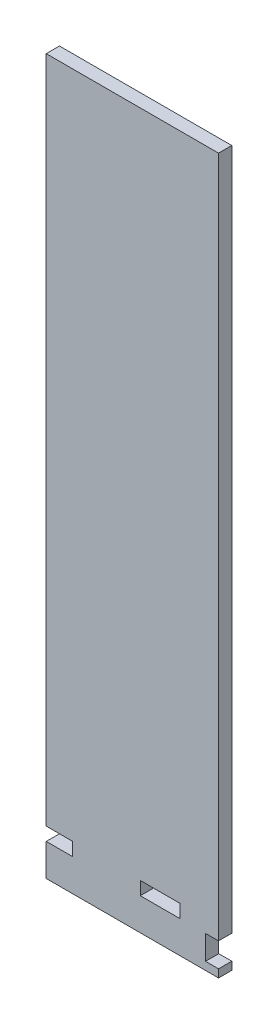
from build123d import *

# Parameters (mm, degrees)
ESQUISSE1_W             = 65.121094869
ESQUISSE1_H             = 270
BOSS_EXTRU_1_DEPTH      = 5
ESQUISSE2_W             = 10
ESQUISSE2_H             = 5
ESQUISSE2_W_2           = 15
ESQUISSE2_W_3           = 4.92
ESQUISSE2_H_2           = 9.15
ENL_V_MAT_EXTRU_1_DEPTH = 5


with BuildPart() as part:
    # Esquisse1 → Boss.-Extru.1 (new body)
    with BuildSketch(Plane.XY):
        with Locations((32.560547435, 135)):
            Rectangle(ESQUISSE1_W, ESQUISSE1_H)
    extrude(amount=-BOSS_EXTRU_1_DEPTH)

    # Esquisse2 → Enlèv. mat.-Extru.1 (cut)
    with BuildSketch(Plane.XY):
        with Locations((5, 14.65)):
            Rectangle(ESQUISSE2_W, ESQUISSE2_H)
        with Locations((43.049292824, 14.65)):
            Rectangle(ESQUISSE2_W_2, ESQUISSE2_H)
        with Locations((62.661094869, 7.575)):
            Rectangle(ESQUISSE2_W_3, ESQUISSE2_H_2)
    extrude(amount=-ENL_V_MAT_EXTRU_1_DEPTH, mode=Mode.SUBTRACT)


solid = part.part
